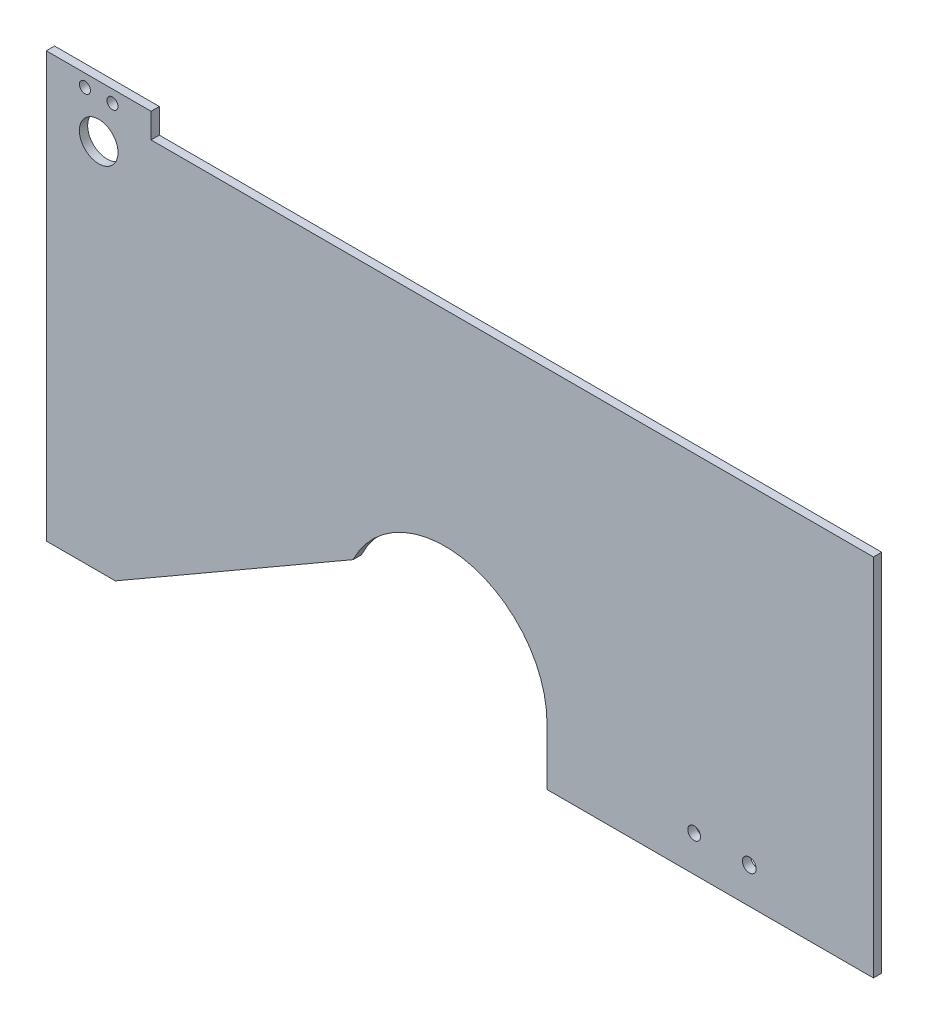
from build123d import *

# Parameters (mm, degrees)
SKETCH2_R           = 7
SKETCH2_R_2         = 2
BOSS_EXTRUDE2_DEPTH = 3
SKETCH3_W           = 118.4
SKETCH3_H           = 12.75
CUT_EXTRUDE1_DEPTH  = 338.231374578
SKETCH5_R           = 2.5
SKETCH5_R_2         = 2.306063735
CUT_EXTRUDE2_DEPTH  = 338.231374578


with BuildPart() as part:
    # Sketch2 → Boss-Extrude2 (new body)
    with BuildSketch(Plane.XY):
        with BuildLine():
            Line((25.03035901, 0), (111.286489227, 49.8))
            ThreePointArc((111.286489227, 49.8), (152.858332199, 69.766604349), (181.6, 33.7))
            Line((181.6, 33.7), (181.6, 0))
            Line((181.6, 0), (300, 0))
            Line((300, 0), (300, 145))
            Line((300, 145), (38, 145))
            Line((38, 145), (38, 154))
            Line((38, 154), (19, 154))
            Line((19, 154), (0, 154))
            Line((0, 154), (0, 0))
            Line((0, 0), (25.03035901, 0))
        make_face()
        with Locations((19, 135)):
            Circle(SKETCH2_R, mode=Mode.SUBTRACT)
        with Locations((14, 149.5)):
            Circle(SKETCH2_R_2, mode=Mode.SUBTRACT)
        with Locations(Location((24, 149.5, 0), (0, 0, 180))):
            Circle(SKETCH2_R_2, mode=Mode.SUBTRACT)
    extrude(amount=BOSS_EXTRUDE2_DEPTH)

    # Sketch3 → Cut-Extrude1 (cut, through all)
    with BuildSketch(Plane.XY.offset(3)):
        with Locations((240.8, 6.375)):
            Rectangle(SKETCH3_W, SKETCH3_H)
    extrude(amount=-CUT_EXTRUDE1_DEPTH, mode=Mode.SUBTRACT)

    # Sketch5 → Cut-Extrude2 (cut, through all)
    with BuildSketch(Plane.XY.offset(3)):
        with Locations((254.98, 25.75)):
            Circle(SKETCH5_R)
        with Locations((234.98, 25.75)):
            Circle(SKETCH5_R_2)
    extrude(amount=-CUT_EXTRUDE2_DEPTH, mode=Mode.SUBTRACT)


solid = part.part
